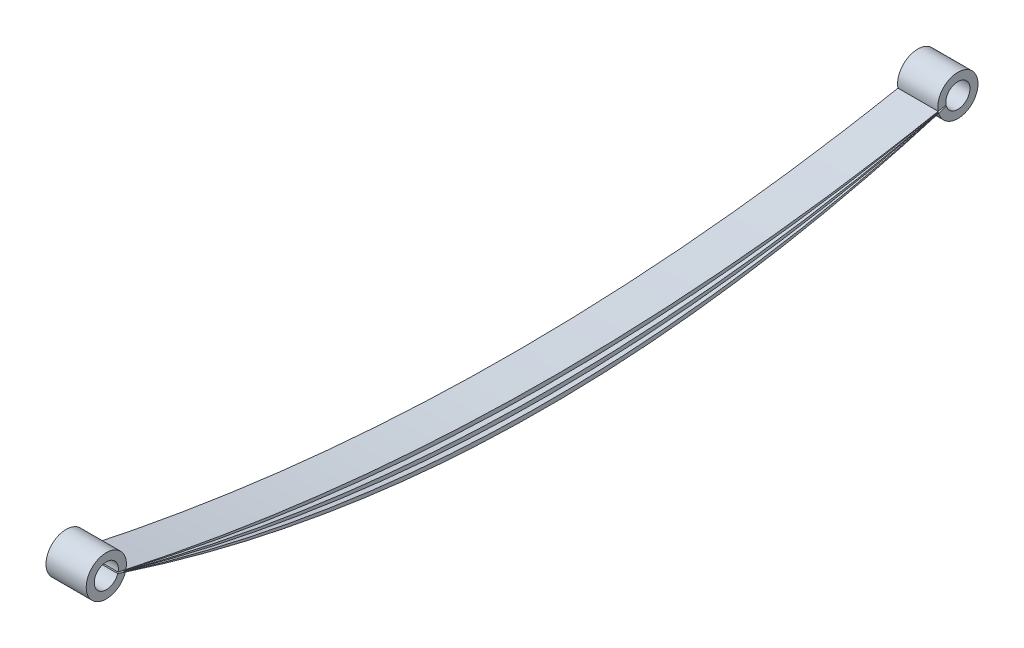
from build123d import *

# Parameters (mm, degrees)
BOSS_EXTRUDE1_DEPTH   = 5
BOSS_EXTRUDE1_2_DEPTH = 5
BOSS_EXTRUDE1_3_DEPTH = 5
BOSS_EXTRUDE1_4_DEPTH = 5
BOSS_EXTRUDE1_5_DEPTH = 5
SKETCH2_R             = 1.5
CUT_EXTRUDE1_DEPTH    = 5
SKETCH3_R             = 1.5
CUT_EXTRUDE2_DEPTH    = 5


with BuildPart() as part:
    # Sketch1 → Boss-Extrude1 (new body)
    with BuildSketch(Plane(origin=(0, 0, 0), x_dir=(0, 0, -1), z_dir=(1, 0, 0))):
        with BuildLine():
            ThreePointArc((-38.122303186, 43.434112385), (-42.972794517, 44.641032213), (-38.189737765, 43.189725997))
            add(Edge.make_bspline(
                [(-40.562857582, 43.976048027), (-39.376442717, 43.574141343), (-38.189737765, 43.189725997)],
                knots=[0, 0, 0, 0.022530034, 0.022530034, 0.022530034], degree=2))
            add(Edge.make_bspline(
                [(-40.562857582, 43.976048027), (-39.342633869, 43.699008033), (-38.122303186, 43.434112385)],
                knots=[0, 0, 0, 0.023090755, 0.023090755, 0.023090755], degree=2))
        make_face()
    extrude(amount=BOSS_EXTRUDE1_DEPTH)

    # Sketch3 → Cut-Extrude2 (cut)
    with BuildSketch(Plane.ZY):
        with Locations((40.562857582, 43.976048027)):
            Circle(SKETCH3_R)
    extrude(amount=-CUT_EXTRUDE2_DEPTH, mode=Mode.SUBTRACT)


with BuildPart() as body_2:
    # Sketch1 → Boss-Extrude1 2 (new body)
    with BuildSketch(Plane(origin=(0, 0, 0), x_dir=(0, 0, -1), z_dir=(1, 0, 0))):
        with BuildLine():
            ThreePointArc((-38.175634118, 43.233643736), (-38.18258465, 43.211652338), (-38.189737765, 43.189725997))
            add(Edge.make_bspline(
                [(-38.189737765, 43.189725997), (12.112467762, 26.895077773), (62.935887165, 42.028055975)],
                knots=[0.022530034, 0.022530034, 0.022530034, 0.977536067, 0.977536067, 0.977536067], degree=2))
            ThreePointArc((62.935887165, 42.028055975), (62.929313429, 42.049968592), (62.922940487, 42.071940447))
            add(Edge.make_bspline(
                [(-38.175634118, 43.233643736), (12.133861989, 27.938763262), (62.922940487, 42.071940447)],
                knots=[0.02265438, 0.02265438, 0.02265438, 0.977405016, 0.977405016, 0.977405016], degree=2))
        make_face()
    extrude(amount=BOSS_EXTRUDE1_2_DEPTH)


with BuildPart() as body_3:
    # Sketch1 → Boss-Extrude1 3 (new body)
    with BuildSketch(Plane(origin=(0, 0, 0), x_dir=(0, 0, -1), z_dir=(1, 0, 0))):
        with BuildLine():
            add(Edge.make_bspline(
                [(-38.122303186, 43.434112385), (12.28502649, 32.492256674), (62.874870389, 42.27119892)],
                knots=[0.023090755, 0.023090755, 0.023090755, 0.97688411, 0.97688411, 0.97688411], degree=2))
            ThreePointArc((-38.122303186, 43.434112385), (-38.127373449, 43.411763489), (-38.132648364, 43.389462009))
            add(Edge.make_bspline(
                [(-38.132648364, 43.389462009), (12.279014036, 31.494728117), (62.884230024, 42.226164301)],
                knots=[0.022995442, 0.022995442, 0.022995442, 0.976974897, 0.976974897, 0.976974897], degree=2))
            ThreePointArc((62.884230024, 42.226164301), (62.879446631, 42.248660084), (62.874870389, 42.27119892))
        make_face()
    extrude(amount=BOSS_EXTRUDE1_3_DEPTH)


with BuildPart() as body_4:
    # Sketch1 → Boss-Extrude1 4 (new body)
    with BuildSketch(Plane(origin=(0, 0, 0), x_dir=(0, 0, -1), z_dir=(1, 0, 0))):
        with BuildLine():
            add(Edge.make_bspline(
                [(62.935887165, 42.028055975), (64.131370598, 42.384018344), (65.327142418, 42.757369565)],
                knots=[0.977536067, 0.977536067, 0.977536067, 1, 1, 1], degree=2))
            ThreePointArc((62.935887165, 42.028055975), (67.751955557, 43.365876955), (62.874870389, 42.27119892))
            add(Edge.make_bspline(
                [(62.874870389, 42.27119892), (64.100952802, 42.508198843), (65.327142418, 42.757369565)],
                knots=[0.97688411, 0.97688411, 0.97688411, 1, 1, 1], degree=2))
        make_face()
    extrude(amount=BOSS_EXTRUDE1_4_DEPTH)

    # Sketch2 → Cut-Extrude1 (cut)
    with BuildSketch(Plane.ZY):
        with Locations((-65.327142418, 42.757369565)):
            Circle(SKETCH2_R)
    extrude(amount=-CUT_EXTRUDE1_DEPTH, mode=Mode.SUBTRACT)


with BuildPart() as body_5:
    # Sketch1 → Boss-Extrude1 5 (new body)
    with BuildSketch(Plane(origin=(0, 0, 0), x_dir=(0, 0, -1), z_dir=(1, 0, 0))):
        with BuildLine():
            ThreePointArc((-38.147423994, 43.331315072), (-38.15340299, 43.30931827), (-38.159582301, 43.287376899))
            add(Edge.make_bspline(
                [(-38.159582301, 43.287376899), (12.266884665, 29.160914613), (62.908962274, 42.12301573)],
                knots=[0.022745643, 0.022745643, 0.022745643, 0.977213051, 0.977213051, 0.977213051], degree=2))
            ThreePointArc((62.908962274, 42.12301573), (62.903250135, 42.145204392), (62.89774159, 42.167444473))
            add(Edge.make_bspline(
                [(-38.147423994, 43.331315072), (12.271822374, 30.175168393), (62.89774159, 42.167444473)],
                knots=[0.022858657, 0.022858657, 0.022858657, 0.977105265, 0.977105265, 0.977105265], degree=2))
        make_face()
    extrude(amount=BOSS_EXTRUDE1_5_DEPTH)


solid = Compound([part.part, body_2.part, body_3.part, body_4.part, body_5.part])
